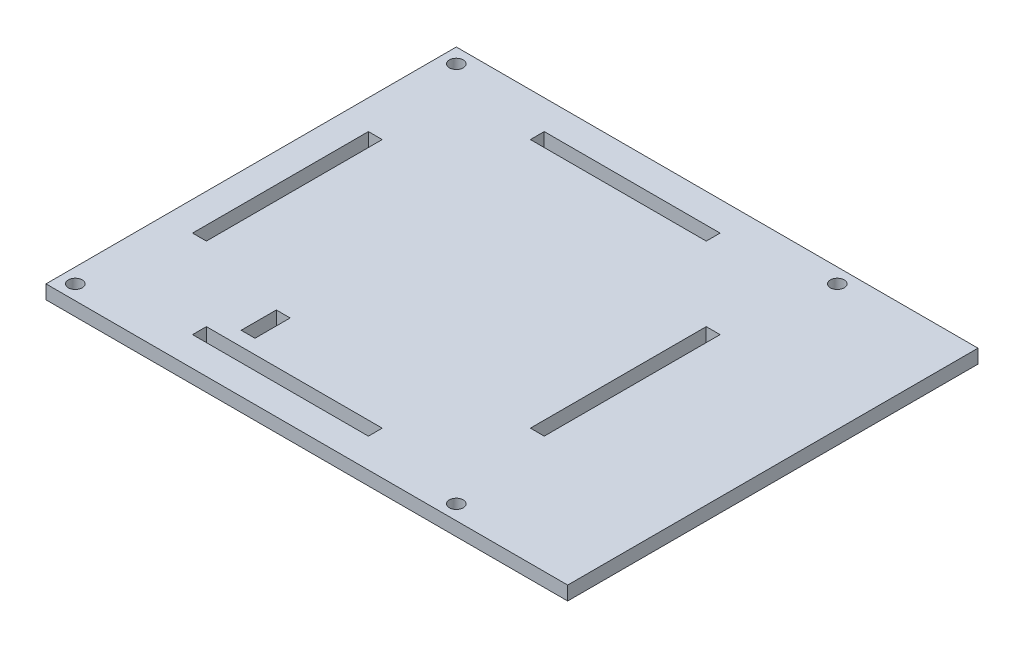
from build123d import *

# Parameters (mm, degrees)
SKETCH_4_W          = 88.9
SKETCH_4_H          = 88.9
SKETCH_4_R          = 1.5
SKETCH_4_W_2        = 38.1
SKETCH_4_H_2        = 3
SKETCH_4_W_3        = 3
SKETCH_4_H_3        = 38.1
EXTRUDE_1_DEPTH     = 3
SKETCH_6_W          = 88.9
SKETCH_6_H          = 3
EXTRUDE_2_DEPTH     = 24.13
SKETCH_7_W          = 3
SKETCH_7_H          = 7.62
CUT_EXTRUDE_1_DEPTH = 3


with BuildPart() as part:
    # 스케치4 → 보스-돌출1 (new body)
    with BuildSketch(Plane(origin=(0, 0, 0), x_dir=(1, 0, 0), z_dir=(0, 1, 0))):
        Rectangle(SKETCH_4_W, SKETCH_4_H)
        with Locations(Location((-41.275, 41.275, 0), (0, 0, 270))):
            Circle(SKETCH_4_R, mode=Mode.SUBTRACT)
        with Locations(Location((41.275, 41.275, 0), (0, 0, 270))):
            Circle(SKETCH_4_R, mode=Mode.SUBTRACT)
        with Locations(Location((41.275, -41.275, 0), (0, 0, 270))):
            Circle(SKETCH_4_R, mode=Mode.SUBTRACT)
        with Locations(Location((-41.275, -41.275, 0), (0, 0, 270))):
            Circle(SKETCH_4_R, mode=Mode.SUBTRACT)
        with Locations((0, 36.6)):
            Rectangle(SKETCH_4_W_2, SKETCH_4_H_2, mode=Mode.SUBTRACT)
        with Locations((36.6, 0)):
            Rectangle(SKETCH_4_W_3, SKETCH_4_H_3, mode=Mode.SUBTRACT)
        with Locations((0, -36.6)):
            Rectangle(SKETCH_4_W_2, SKETCH_4_H_2, mode=Mode.SUBTRACT)
        with Locations((-36.6, 0)):
            Rectangle(SKETCH_4_W_3, SKETCH_4_H_3, mode=Mode.SUBTRACT)
    extrude(amount=EXTRUDE_1_DEPTH)

    # 스케치6 → 보스-돌출2 (add)
    with BuildSketch(Plane(origin=(44.45, 0, 0), x_dir=(0, 0, -1), z_dir=(1, 0, 0))):
        with Locations((0, 1.5)):
            Rectangle(SKETCH_6_W, SKETCH_6_H)
    extrude(amount=EXTRUDE_2_DEPTH)

    # 스케치7 → 컷-돌출1 (cut)
    with BuildSketch(Plane(origin=(0, 3, 0), x_dir=(1, 0, 0), z_dir=(0, 1, 0))):
        with Locations((-13.1, -28.21025)):
            Rectangle(SKETCH_7_W, SKETCH_7_H)
    extrude(amount=-CUT_EXTRUDE_1_DEPTH, mode=Mode.SUBTRACT)


solid = part.part
